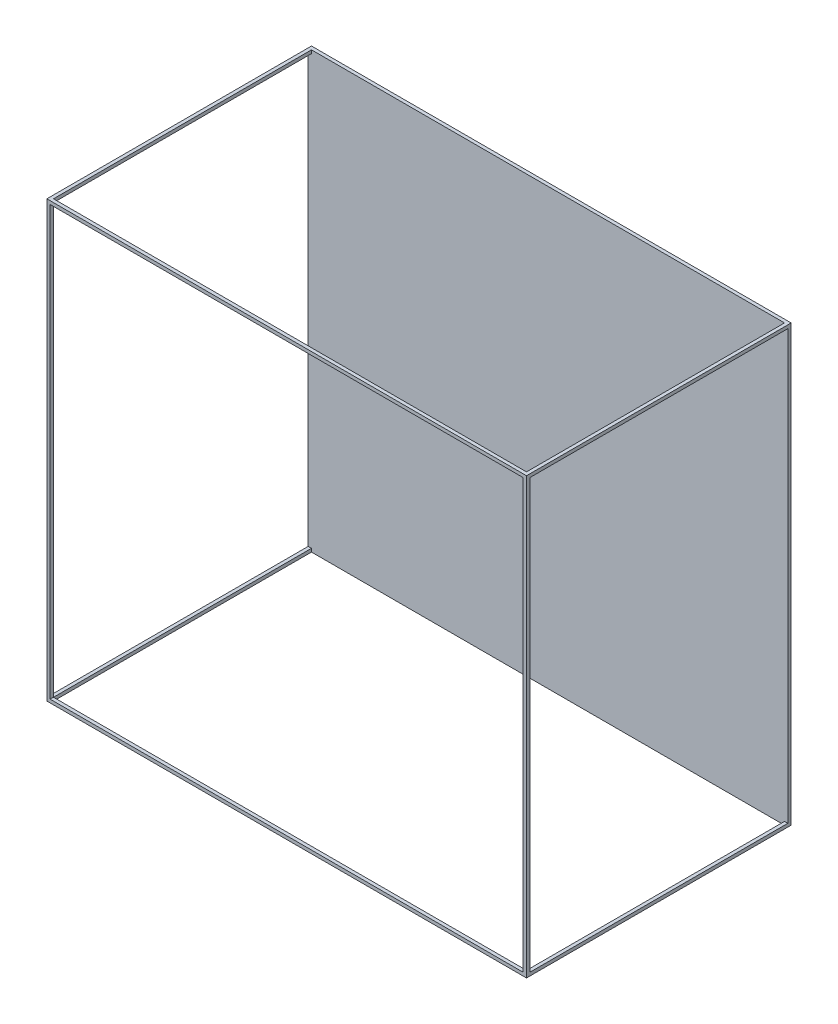
from build123d import *

# Parameters (mm, degrees)
CROQUIS1_W              = 145
CROQUIS1_H              = 131.5
SALIENTE_EXTRUIR1_DEPTH = 40
VACIADO1_T              = -1
CROQUIS2_W              = 143
CROQUIS2_H              = 78
CORTAR_EXTRUIR1_DEPTH   = 160
CROQUIS3_W              = 78
CROQUIS3_H              = 129.5
CORTAR_EXTRUIR2_DEPTH   = 180


with BuildPart() as part:
    # Croquis1 → Saliente-Extruir1 (new, symmetric)
    with BuildSketch(Plane.XY):
        Rectangle(CROQUIS1_W, CROQUIS1_H)
    extrude(amount=SALIENTE_EXTRUIR1_DEPTH, both=True)

    # Vaciado1
    vaciado1_openings = [part.faces().sort_by_distance(p)[0] for p in [
        (0, 0, 40),
    ]]
    offset(amount=VACIADO1_T, openings=vaciado1_openings, kind=Kind.INTERSECTION)

    # Croquis2 → Cortar-Extruir1 (cut)
    with BuildSketch(Plane(origin=(0, 65.75, 0), x_dir=(1, 0, 0), z_dir=(0, 1, 0))):
        Rectangle(CROQUIS2_W, CROQUIS2_H)
    extrude(amount=-CORTAR_EXTRUIR1_DEPTH, mode=Mode.SUBTRACT)

    # Croquis3 → Cortar-Extruir2 (cut)
    with BuildSketch(Plane(origin=(72.5, 0, 0), x_dir=(0, 0, -1), z_dir=(1, 0, 0))):
        Rectangle(CROQUIS3_W, CROQUIS3_H)
    extrude(amount=-CORTAR_EXTRUIR2_DEPTH, mode=Mode.SUBTRACT)


solid = part.part
